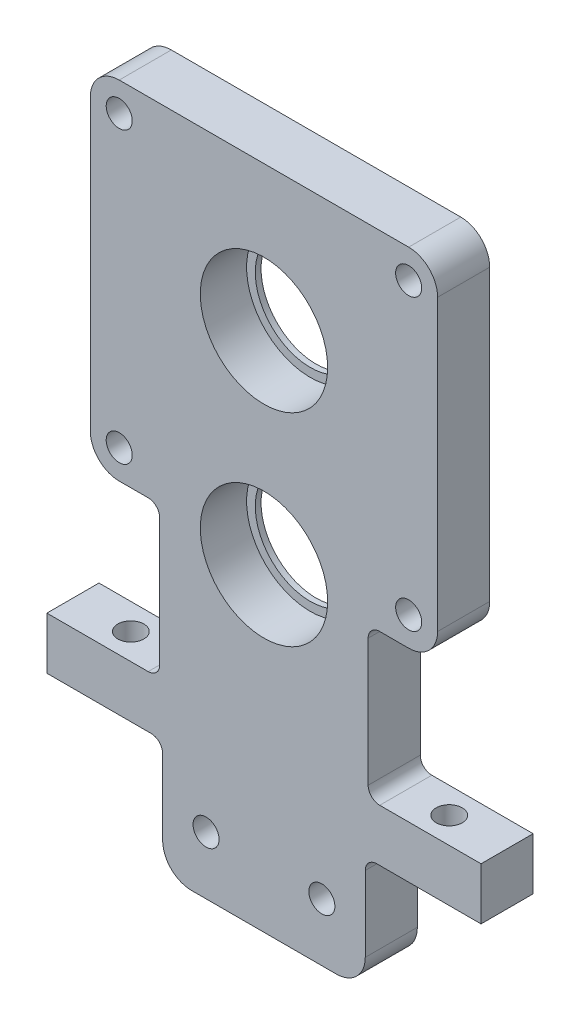
from build123d import *

# Parameters (mm, degrees)
ESQUISSE1_W                  = 75
ESQUISSE1_H                  = 95
BOSS_EXTRU_1_DEPTH           = 9
ESQUISSE2_W                  = 35
ESQUISSE2_H                  = 20
BOSS_EXTRU_2_DEPTH           = 9
ESQUISSE3_R                  = 11
ENL_V_MAT_EXTRU_1_DEPTH      = 8
ESQUISSE4_R                  = 9.5
ENL_V_MAT_EXTRU_2_DEPTH      = 122.371331047
ENL_V_MAT_EXTRU_3_DEPTH      = 122.371331047
ENL_V_MAT_EXTRU_3_DEPTH_BACK = 122.371331047
ESQUISSE5_W                  = 7.5
ESQUISSE5_H                  = 86
ENL_V_START                  = -9
ESQUISSE8_W                  = 12
ESQUISSE8_H                  = 26
ENL_V_MAT_EXTRU_6_DEPTH      = 9
CONG_1_R                     = 2
CONG_2_R                     = 5
ESQUISSE6_R                  = 2.25
ENL_V_MAT_EXTRU_4_DEPTH      = 122.371331047
ESQUISSE7_R                  = 2.25
ENL_V_MAT_EXTRU_5_DEPTH      = 115.46396813


with BuildPart() as part:
    # Esquisse1 → Boss.-Extru.1 (new body)
    with BuildSketch(Plane.XY):
        with Locations((37.5, 47.5)):
            Rectangle(ESQUISSE1_W, ESQUISSE1_H)
    extrude(amount=BOSS_EXTRU_1_DEPTH)

    # Esquisse2 → Boss.-Extru.2 (add)
    with BuildSketch(Plane.XY.offset(9)):
        with Locations((37.5, -10)):
            Rectangle(ESQUISSE2_W, ESQUISSE2_H)
    extrude(amount=-BOSS_EXTRU_2_DEPTH)

    # Esquisse3 → Enlèv. mat.-Extru.1 (cut)
    with BuildSketch(Plane.XY.offset(9)):
        with Locations((37.5, 70)):
            Circle(ESQUISSE3_R)
        with Locations((37.5, 35)):
            Circle(ESQUISSE3_R)
    extrude(amount=-ENL_V_MAT_EXTRU_1_DEPTH, mode=Mode.SUBTRACT)

    # Esquisse4 → Enlèv. mat.-Extru.2 (cut, through all)
    with BuildSketch(Plane.XY.offset(9)):
        with Locations((37.5, 70)):
            Circle(ESQUISSE4_R)
        with Locations((37.5, 35)):
            Circle(ESQUISSE4_R)
    extrude(amount=-ENL_V_MAT_EXTRU_2_DEPTH, mode=Mode.SUBTRACT)

    # Esquisse5 → Enlèv. mat.-Extru.3 (cut, two sides: drawn at the far end of the back side and taken through both)
    with BuildSketch(Plane.XY.offset(9).offset(-ENL_V_MAT_EXTRU_3_DEPTH_BACK)):
        with Locations((71.25, 52)):
            Rectangle(ESQUISSE5_W, ESQUISSE5_H)
        with Locations((3.75, 52)):
            Rectangle(ESQUISSE5_W, ESQUISSE5_H)
    extrude(amount=ENL_V_MAT_EXTRU_3_DEPTH + ENL_V_MAT_EXTRU_3_DEPTH_BACK, mode=Mode.SUBTRACT)

    # Esquisse8 → Enlèv. mat.-Extru.6 (cut)
    with BuildSketch(Plane.XY.offset(9).offset(ENL_V_START)):
        with Locations((13.5, 22)):
            Rectangle(ESQUISSE8_W, ESQUISSE8_H)
        with Locations((61.5, 22)):
            Rectangle(ESQUISSE8_W, ESQUISSE8_H)
    extrude(amount=ENL_V_MAT_EXTRU_6_DEPTH, mode=Mode.SUBTRACT)

    # Congé1
    cong_1_edges = [part.edges().sort_by_distance(p)[0] for p in [
        (55.5, 9, 4.5),
        (55.5, 35, 4.5),
        (20, 0, 4.5),
        (55, 0, 4.5),
        (19.5, 35, 4.5),
        (19.5, 9, 4.5),
    ]]
    fillet(cong_1_edges, radius=CONG_1_R)

    # Congé2
    cong_2_edges = [part.edges().sort_by_distance(p)[0] for p in [
        (67.5, 35, 4.5),
        (20, -20, 4.5),
        (55, -20, 4.5),
        (67.5, 95, 4.5),
        (7.5, 95, 4.5),
        (7.5, 35, 4.5),
    ]]
    fillet(cong_2_edges, radius=CONG_2_R)

    # Esquisse6 → Enlèv. mat.-Extru.4 (cut, through all)
    with BuildSketch(Plane.XY.offset(9)):
        with Locations((47.5, -10)):
            Circle(ESQUISSE6_R)
        with Locations(Location((27.5, -10, 0), (0, 0, 180))):
            Circle(ESQUISSE6_R)
        with Locations((12.5, 90)):
            Circle(ESQUISSE6_R)
        with Locations((12.5, 40)):
            Circle(ESQUISSE6_R)
        with Locations(Location((62.5, 40, 0), (0, 0, 180))):
            Circle(ESQUISSE6_R)
        with Locations(Location((62.5, 90, 0), (0, 0, 180))):
            Circle(ESQUISSE6_R)
    extrude(amount=-ENL_V_MAT_EXTRU_4_DEPTH, mode=Mode.SUBTRACT)

    # Esquisse7 → Enlèv. mat.-Extru.5 (cut, through all)
    with BuildSketch(Plane(origin=(0, 9, 0), x_dir=(1, 0, 0), z_dir=(0, 1, 0))):
        with Locations(Location((10, -4.5, 0), (0, 0, 180))):
            Circle(ESQUISSE7_R)
        with Locations(Location((65, -4.5, 0), (0, 0, 270))):
            Circle(ESQUISSE7_R)
    extrude(amount=-ENL_V_MAT_EXTRU_5_DEPTH, mode=Mode.SUBTRACT)


solid = part.part
